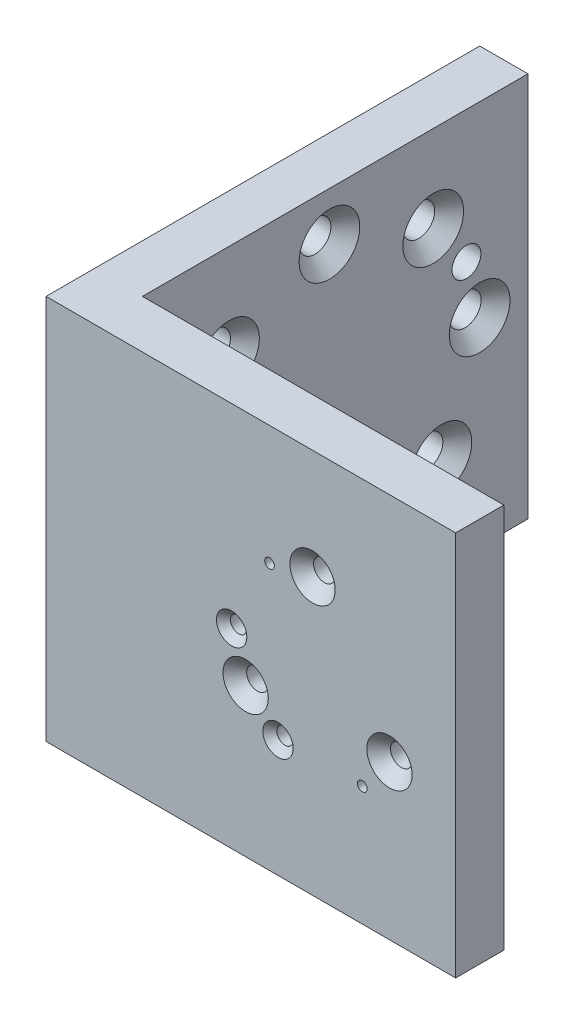
from build123d import *

# Parameters (mm, degrees)
SKETCH_1_W                  = 85
SKETCH_1_H                  = 90
EXTRUDE_1_DEPTH             = 80
SKETCH_2_W                  = 75
SKETCH_2_H                  = 80
CUT_EXTRUDE_1_DEPTH         = 148.39402973
HOLE_WIZARD_6_6_6_6_1_D     = 6.6
HOLE_WIZARD_6_0_6_1_D       = 6
HOLE_WIZARD_6_0_6_1_DEPTH   = 85
HOLE_WIZARD_2_0_2_1_D       = 2
HOLE_WIZARD_4_5_4_5_1_D     = 4.5
HOLE_WIZARD_4_5_4_5_1_DEPTH = 90
HOLE_WIZARD_3_4_3_4_1_D     = 3.4
HOLE_WIZARD_3_4_3_4_1_DEPTH = 90
CHAMFER_1_SIZE              = 3
CHAMFER_2_SIZE              = 2.45
CHAMFER_3_SIZE              = 1.45


with BuildPart() as part:
    # 草圖1 → 填料-伸長1 (new body)
    with BuildSketch(Plane.XZ):
        with Locations((42.5, 45)):
            Rectangle(SKETCH_1_W, SKETCH_1_H)
    extrude(amount=-EXTRUDE_1_DEPTH)

    # 草圖2 → 除料-伸長1 (cut, through all)
    with BuildSketch(Plane(origin=(0, 80, 0), x_dir=(-1, 0, 0), z_dir=(0, 1, 0))):
        with Locations((-47.5, 40)):
            Rectangle(SKETCH_2_W, SKETCH_2_H)
    extrude(amount=-CUT_EXTRUDE_1_DEPTH, mode=Mode.SUBTRACT)

    # Ø6.6 (6.6) 直徑孔1 (through all)
    with Locations(Plane(origin=(10, 0, 0), x_dir=(0, 0, -1), z_dir=(1, 0, 0))):
        with Locations((-38.807552288, 10.023708227), (-60.353251324, 17.960372949), (-69.976291773, 38.807552288), (-62.039627051, 60.353251324), (-41.192447712, 69.976291773), (-19.646748676, 62.039627051), (-10.023708227, 41.192447712), (-17.960372949, 19.646748676)):
            Hole(HOLE_WIZARD_6_6_6_6_1_D / 2)

    # Ø6.0 (6) 直徑孔1
    with Locations(Plane.ZY):
        with Locations((12.761847554, 52.57310826), (67.238152446, 27.42689174)):
            Hole(HOLE_WIZARD_6_0_6_1_D / 2, depth=HOLE_WIZARD_6_0_6_1_DEPTH)

    # Ø2.0 (2) 直徑孔1 (through all)
    with Locations(Plane(origin=(0, 0, 80), x_dir=(-1, 0, 0), z_dir=(0, 0, -1))):
        with Locations((-46.377364171, 55.211997886), (-65.622635829, 24.788002114)):
            Hole(HOLE_WIZARD_2_0_2_1_D / 2)

    # Ø4.5 (4.5) 直徑孔1
    with Locations(Plane.XY.offset(90)):
        with Locations((71.275302439, 31.985785415), (41.421835359, 30.77830733), (55.302862202, 57.235907255)):
            Hole(HOLE_WIZARD_4_5_4_5_1_D / 2, depth=HOLE_WIZARD_4_5_4_5_1_DEPTH)

    # Ø3.4 (3.4) 直徑孔1
    with Locations(Plane.XY.offset(90)):
        with Locations((48.134653009, 24.375137866), (38.51201718, 39.587135752)):
            Hole(HOLE_WIZARD_3_4_3_4_1_D / 2, depth=HOLE_WIZARD_3_4_3_4_1_DEPTH)

    # 導角1
    chamfer_1_edges = [part.edges().sort_by_distance(p)[0] for p in [
        (10, 19.646748676, 14.660372949),
        (10, 41.192447712, 6.723708227),
        (10, 62.039627051, 16.346748676),
        (10, 69.976291773, 37.892447712),
        (10, 60.353251324, 58.739627051),
        (10, 38.807552288, 66.676291773),
        (10, 17.960372949, 57.053251324),
        (10, 10.023708227, 35.507552288),
    ]]
    chamfer(chamfer_1_edges, length=CHAMFER_1_SIZE)

    # 導角2
    chamfer_2_edges = [part.edges().sort_by_distance(p)[0] for p in [
        (43.671835359, 30.77830733, 90),
        (73.525302439, 31.985785415, 90),
        (57.552862202, 57.235907255, 90),
    ]]
    chamfer(chamfer_2_edges, length=CHAMFER_2_SIZE)

    # 導角3
    chamfer_3_edges = [part.edges().sort_by_distance(p)[0] for p in [
        (40.21201718, 39.587135752, 90),
        (49.834653009, 24.375137866, 90),
    ]]
    chamfer(chamfer_3_edges, length=CHAMFER_3_SIZE)


solid = part.part
